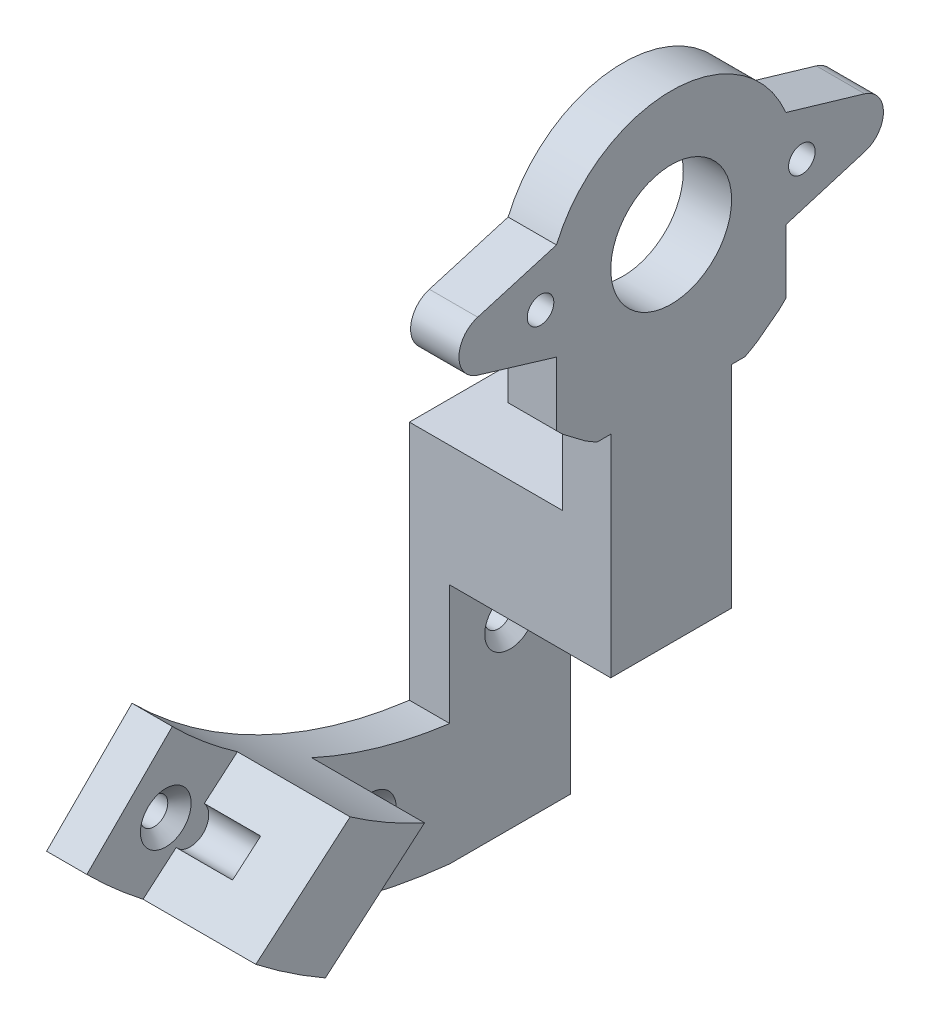
from build123d import *

# Parameters (mm, degrees)
SKETCH1_W                                       = 15
SKETCH1_H                                       = 45
BOSS_EXTRUDE1_DEPTH                             = 5
SKETCH2_W                                       = 15
SKETCH2_H                                       = 15
BOSS_EXTRUDE2_DEPTH                             = 14
SKETCH3_R                                       = 2.3
CUT_EXTRUDE1_DEPTH                              = 7
SKETCH4_R                                       = 7.5
SKETCH4_R_2                                     = 1.65
BOSS_EXTRUDE3_DEPTH                             = 6
CSK_FOR_M3_FLAT_HEAD_MACHINE_SCREW1_D           = 3.4
CSK_FOR_M3_FLAT_HEAD_MACHINE_SCREW1_DEPTH       = 6.35
CSK_FOR_M3_FLAT_HEAD_MACHINE_SCREW1_CSINK_D     = 6.3
CSK_FOR_M3_FLAT_HEAD_MACHINE_SCREW1_CSINK_ANGLE = 90
CSK_FOR_M3_FLAT_HEAD_MACHINE_SCREW1_TIP         = 1.021463052


with BuildPart() as part:
    # Sketch1 → Boss-Extrude1 (new body)
    with BuildSketch(Plane(origin=(0, 0, 0), x_dir=(0, 0, -1), z_dir=(1, 0, 0))):
        with BuildLine():
            Line((-33.857008974, 2.735870452), (-45.565370995, -7.267550065))
            ThreePointArc((-45.565370995, -7.267550065), (-27.604171468, -17.561381798), (-7.5, -22.5))
            Line((-7.5, -22.5), (-7.5, -7.403306871))
            ThreePointArc((-7.5, -7.403306871), (-21.290873092, -3.925583536), (-33.857008974, 2.735870452))
        make_face()
        Rectangle(SKETCH1_W, SKETCH1_H)
        with BuildLine():
            Line((-41.931432124, 9.489065709), (-52.538033842, -1.117536008))
            ThreePointArc((-52.538033842, -1.117536008), (-49.147992618, -4.301713372), (-45.565370995, -7.267550065))
            Line((-45.565370995, -7.267550065), (-33.857008974, 2.735870452))
            ThreePointArc((-33.857008974, 2.735870452), (-38.044360457, 5.932954073), (-41.931432124, 9.489065709))
        make_face()
    extrude(amount=BOSS_EXTRUDE1_DEPTH)

    # Sketch2 → Boss-Extrude2 (add)
    with BuildSketch(Plane(origin=(5, 0, 0), x_dir=(0, 0, -1), z_dir=(1, 0, 0))):
        with BuildLine():
            Line((-45.563203072, -7.269233174), (-33.854727787, 2.734284113))
            ThreePointArc((-33.854727787, 2.734284113), (-29.354954434, -0.104026911), (-24.61890521, -2.52762082))
            Line((-24.61890521, -2.52762082), (-36.933994133, -13.049418231))
            ThreePointArc((-36.933994133, -13.049418231), (-41.349722145, -10.310292527), (-45.563203072, -7.269233174))
        make_face()
        with Locations((0, 15)):
            Rectangle(SKETCH2_W, SKETCH2_H)
    extrude(amount=BOSS_EXTRUDE2_DEPTH)

    # Sketch3 → Cut-Extrude1 (cut)
    with BuildSketch(Plane(origin=(5, 0, 0), x_dir=(0, 0, -1), z_dir=(1, 0, 0))):
        with Locations((-39.70896543, -2.267474531)):
            Circle(SKETCH3_R)
    extrude(amount=CUT_EXTRUDE1_DEPTH, mode=Mode.SUBTRACT)

    # Sketch4 → Boss-Extrude3 (add)
    with BuildSketch(Plane(origin=(19, 0, 0), x_dir=(0, 0, -1), z_dir=(1, 0, 0))):
        with BuildLine():
            Line((-7.5, 33.697965455), (-7.5, 7.5))
            Line((-7.5, 7.5), (7.5, 7.5))
            Line((7.5, 7.5), (7.5, 33.697965455))
            Line((7.5, 33.697965455), (9.165031814, 33.697965455))
            ThreePointArc((9.165031814, 33.697965455), (9.933965272, 34.117264651), (10.683756157, 34.569905907))
            Line((10.683756157, 34.569905907), (13.30556247, 36.552911383))
            ThreePointArc((13.30556247, 36.552911383), (13.786023096, 36.997313573), (14.25164947, 37.457235089))
            Line((14.25164947, 37.457235089), (14.25164947, 45.3641606))
            Line((14.25164947, 45.3641606), (24.03628358, 48.30778647))
            ThreePointArc((24.03628358, 48.30778647), (26.349985315, 51.429769983), (24.017555191, 54.53778647))
            Line((24.017555191, 54.53778647), (14.241296463, 57.414910041))
            ThreePointArc((14.241296463, 57.414910041), (0, 66.87164947), (-14.241296463, 57.414910041))
            Line((-14.241296463, 57.414910041), (-24.017555191, 54.53778647))
            ThreePointArc((-24.017555191, 54.53778647), (-26.349985315, 51.429769983), (-24.03628358, 48.30778647))
            Line((-24.03628358, 48.30778647), (-14.25164947, 45.3641606))
            Line((-14.25164947, 45.3641606), (-14.25164947, 37.457235089))
            ThreePointArc((-14.25164947, 37.457235089), (-13.786023096, 36.997313573), (-13.30556247, 36.552911383))
            Line((-13.30556247, 36.552911383), (-10.683756157, 34.569905907))
            ThreePointArc((-10.683756157, 34.569905907), (-9.933965272, 34.117264651), (-9.165031814, 33.697965455))
            Line((-9.165031814, 33.697965455), (-7.5, 33.697965455))
        make_face()
        with Locations((0, 51.42)):
            Circle(SKETCH4_R, mode=Mode.SUBTRACT)
        with Locations((16.22, 51.42)):
            Circle(SKETCH4_R_2, mode=Mode.SUBTRACT)
        with Locations((-16.22, 51.42)):
            Circle(SKETCH4_R_2, mode=Mode.SUBTRACT)
    extrude(amount=BOSS_EXTRUDE3_DEPTH)

    # CSK for M3 Flat Head Machine Screw1
    with Locations(Plane(origin=(5, 0, 0), x_dir=(0, 0, -1), z_dir=(1, 0, 0))):
        with Locations((-42.74343682, 0.09035829), (-17.288987754, -13.103380711), (0, 0), (0, 51.42)):
            CounterSinkHole(CSK_FOR_M3_FLAT_HEAD_MACHINE_SCREW1_D / 2, CSK_FOR_M3_FLAT_HEAD_MACHINE_SCREW1_CSINK_D / 2, depth=CSK_FOR_M3_FLAT_HEAD_MACHINE_SCREW1_DEPTH, counter_sink_angle=CSK_FOR_M3_FLAT_HEAD_MACHINE_SCREW1_CSINK_ANGLE)
            with Locations((0, 0, -(CSK_FOR_M3_FLAT_HEAD_MACHINE_SCREW1_DEPTH + CSK_FOR_M3_FLAT_HEAD_MACHINE_SCREW1_TIP / 2))):  # 118° drill point
                Cone(0, CSK_FOR_M3_FLAT_HEAD_MACHINE_SCREW1_D / 2, CSK_FOR_M3_FLAT_HEAD_MACHINE_SCREW1_TIP, mode=Mode.SUBTRACT)


solid = part.part
